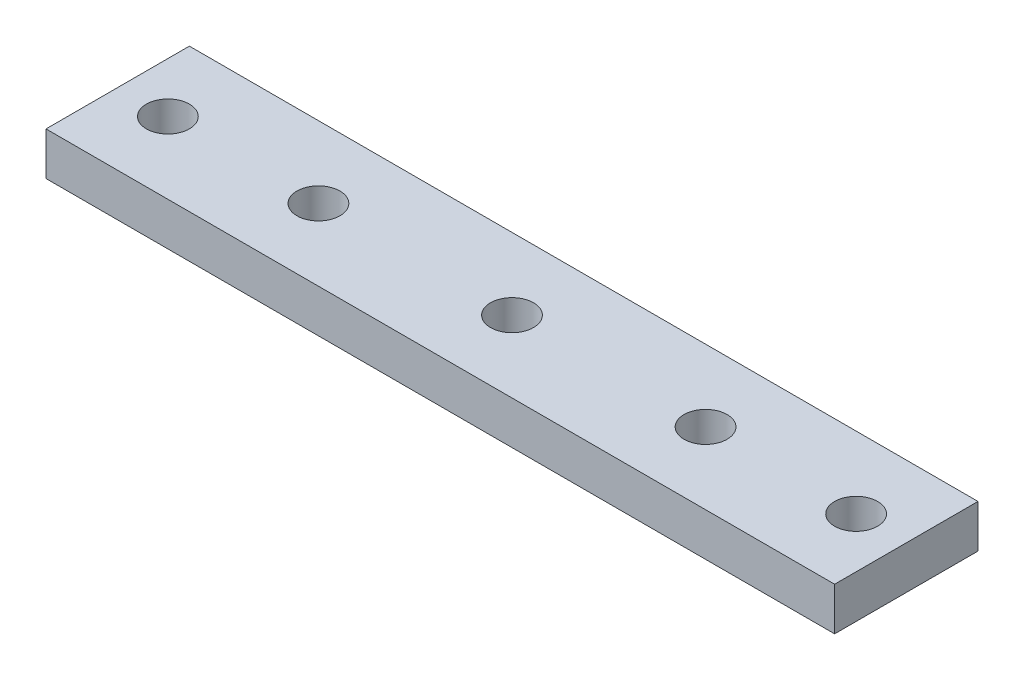
from build123d import *

# Parameters (mm, degrees)
ESBO_O1_W                = 110
ESBO_O1_H                = 20
ESBO_O1_R                = 3
RESSALTO_EXTRUS_O1_DEPTH = 6


with BuildPart() as part:
    # Esboço1 → Ressalto-extrusão1 (new body)
    with BuildSketch(Plane(origin=(0, 0, 0), x_dir=(1, 0, 0), z_dir=(0, 1, 0))):
        with Locations((55, 10)):
            Rectangle(ESBO_O1_W, ESBO_O1_H)
        with Locations(Location((28, 10, 0), (0, 0, 270))):
            Circle(ESBO_O1_R, mode=Mode.SUBTRACT)
        with Locations(Location((82, 10, 0), (0, 0, 270))):
            Circle(ESBO_O1_R, mode=Mode.SUBTRACT)
        with Locations(Location((7, 10, 0), (0, 0, 270))):
            Circle(ESBO_O1_R, mode=Mode.SUBTRACT)
        with Locations(Location((103, 10, 0), (0, 0, 270))):
            Circle(ESBO_O1_R, mode=Mode.SUBTRACT)
        with Locations(Location((55, 10, 0), (0, 0, 270))):
            Circle(ESBO_O1_R, mode=Mode.SUBTRACT)
    extrude(amount=RESSALTO_EXTRUS_O1_DEPTH)


solid = part.part
